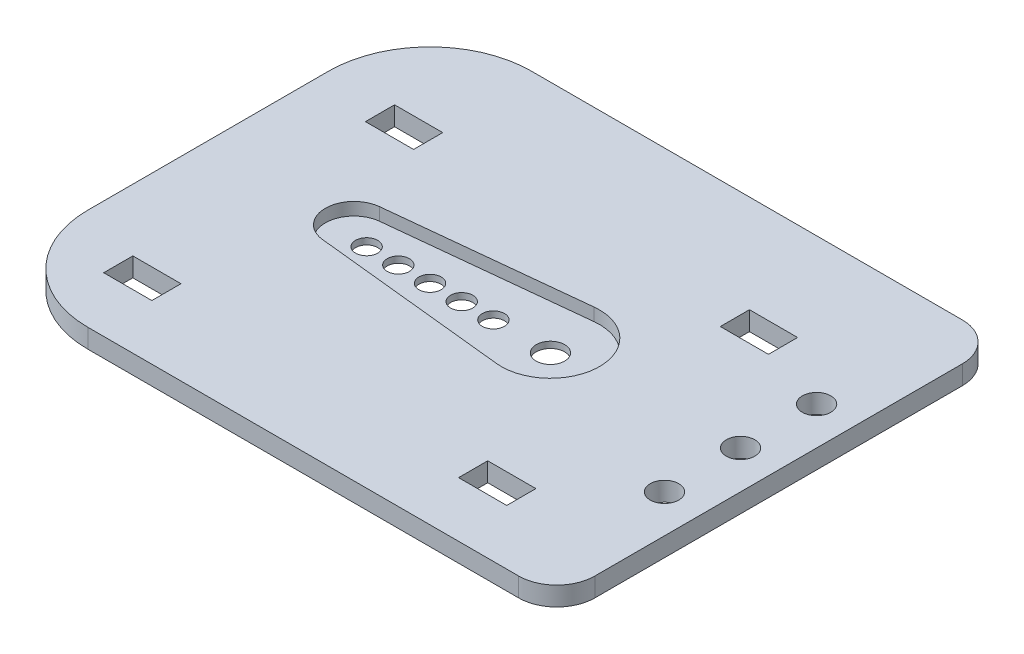
from build123d import *

# Parameters (mm, degrees)
SALIENTE_EXTRUIR1_DEPTH = 1.5
CORTAR_EXTRUIR1_DEPTH   = 1
CROQUIS3_R              = 1.125
CROQUIS3_W              = 3.8
CROQUIS3_H              = 2.3
CORTAR_EXTRUIR2_DEPTH   = 1
CROQUIS4_R              = 0.875
CORTAR_EXTRUIR3_DEPTH   = 10


with BuildPart() as part:
    # Croquis1 → Saliente-Extruir1 (new body)
    with BuildSketch(Plane(origin=(0, 0, 0), x_dir=(1, 0, 0), z_dir=(0, 1, 0))):
        with BuildLine():
            Line((-14.5, -17.5), (19.5, -17.5))
            ThreePointArc((19.5, -17.5), (21.621320344, -16.621320344), (22.5, -14.5))
            Line((22.5, -14.5), (22.5, 14.5))
            ThreePointArc((22.5, 14.5), (21.621320344, 16.621320344), (19.5, 17.5))
            Line((19.5, 17.5), (-14.5, 17.5))
            ThreePointArc((-14.5, 17.5), (-20.156854249, 15.156854249), (-22.5, 9.5))
            Line((-22.5, 9.5), (-22.5, -9.5))
            ThreePointArc((-22.5, -9.5), (-20.156854249, -15.156854249), (-14.5, -17.5))
        make_face()
    extrude(amount=SALIENTE_EXTRUIR1_DEPTH)

    # Croquis2 → Cortar-Extruir1 (cut)
    with BuildSketch(Plane(origin=(0, 1.5, 0), x_dir=(1, 0, 0), z_dir=(0, 1, 0))):
        with BuildLine():
            Line((-11.235477419, 2.247698909), (4.09625, 3.853908527))
            ThreePointArc((4.09625, 3.853908527), (8.375, 0), (4.09625, -3.853908527))
            Line((4.09625, -3.853908527), (-11.235477419, -2.247698909))
            ThreePointArc((-11.235477419, -2.247698909), (-13.26, 0), (-11.235477419, 2.247698909))
        make_face()
    extrude(amount=-CORTAR_EXTRUIR1_DEPTH, mode=Mode.SUBTRACT)

    # Croquis3 → Cortar-Extruir2 (cut, symmetric)
    with BuildSketch(Plane(origin=(0, 0.5, 0), x_dir=(1, 0, 0), z_dir=(0, 1, 0))):
        with Locations(Location((4.5, 0, 0), (0, 0, 270))):
            Circle(CROQUIS3_R)
        with Locations(Location((19.5, 6, 0), (0, 0, 270))):
            Circle(CROQUIS3_R)
        with Locations(Location((19.5, -6, 0), (0, 0, 270))):
            Circle(CROQUIS3_R)
        with Locations(Location((19.5, 0, 0), (0, 0, 270))):
            Circle(CROQUIS3_R)
        with Locations((-15.697233885, 8.65)):
            Rectangle(CROQUIS3_W, CROQUIS3_H)
        with Locations((-15.697233885, -12)):
            Rectangle(CROQUIS3_W, CROQUIS3_H)
        with Locations((12.302766115, -12)):
            Rectangle(CROQUIS3_W, CROQUIS3_H)
        with Locations((12.302766115, 8.65)):
            Rectangle(CROQUIS3_W, CROQUIS3_H)
    extrude(amount=CORTAR_EXTRUIR2_DEPTH, both=True, mode=Mode.SUBTRACT)

    # Croquis4 → Cortar-Extruir3 (cut)
    with BuildSketch(Plane(origin=(0, 1.5, 0), x_dir=(1, 0, 0), z_dir=(0, 1, 0))):
        with Locations(Location((0, 0, 0), (0, 0, 270))):
            Circle(CROQUIS4_R)
        with Locations(Location((-5, 0, 0), (0, 0, 270))):
            Circle(CROQUIS4_R)
        with Locations(Location((-2.5, 0, 0), (0, 0, 270))):
            Circle(CROQUIS4_R)
        with Locations(Location((-7.5, 0, 0), (0, 0, 270))):
            Circle(CROQUIS4_R)
        with Locations(Location((-10, 0, 0), (0, 0, 270))):
            Circle(CROQUIS4_R)
    extrude(amount=-CORTAR_EXTRUIR3_DEPTH, mode=Mode.SUBTRACT)


solid = part.part
